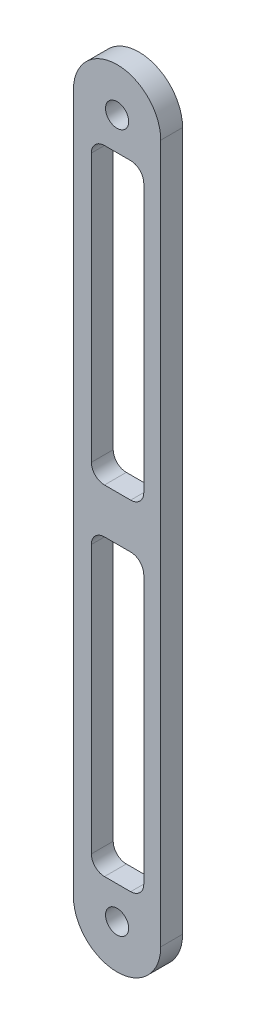
from build123d import *

# Parameters (mm, degrees)
SKETCH_1_R      = 2.65
SKETCH_1_W      = 12
SKETCH_1_H      = 67.337004634
SKETCH_1_H_2    = 67.362830637
EXTRUDE_1_DEPTH = 5
FILLET_1_R      = 3


with BuildPart() as part:
    # 草图1 → 凸台-拉伸1 (new body)
    with BuildSketch(Plane.XY):
        with BuildLine():
            Line((-10, 80), (-10, -80))
            ThreePointArc((-10, -80), (0, -90), (10, -80))
            Line((10, -80), (10, 80))
            ThreePointArc((10, 80), (0, 90), (-10, 80))
        make_face()
        with Locations((0, 80)):
            Circle(SKETCH_1_R, mode=Mode.SUBTRACT)
        with Locations((0, -80)):
            Circle(SKETCH_1_R, mode=Mode.SUBTRACT)
        with Locations((0.111968731, 38.831497683)):
            Rectangle(SKETCH_1_W, SKETCH_1_H, mode=Mode.SUBTRACT)
        with Locations((0.111968731, -38.818584681)):
            Rectangle(SKETCH_1_W, SKETCH_1_H_2, mode=Mode.SUBTRACT)
    extrude(amount=EXTRUDE_1_DEPTH)

    # 圆角1
    fillet_1_edges = [part.edges().sort_by_distance(p)[0] for p in [
        (-5.888031269, 5.162995366, 2.5),
        (6.111968731, 5.162995366, 2.5),
        (6.111968731, 72.5, 2.5),
        (-5.888031269, 72.5, 2.5),
        (-5.888031269, -5.137169363, 2.5),
        (-5.888031269, -72.5, 2.5),
        (6.111968731, -72.5, 2.5),
        (6.111968731, -5.137169363, 2.5),
    ]]
    fillet(fillet_1_edges, radius=FILLET_1_R)


solid = part.part
